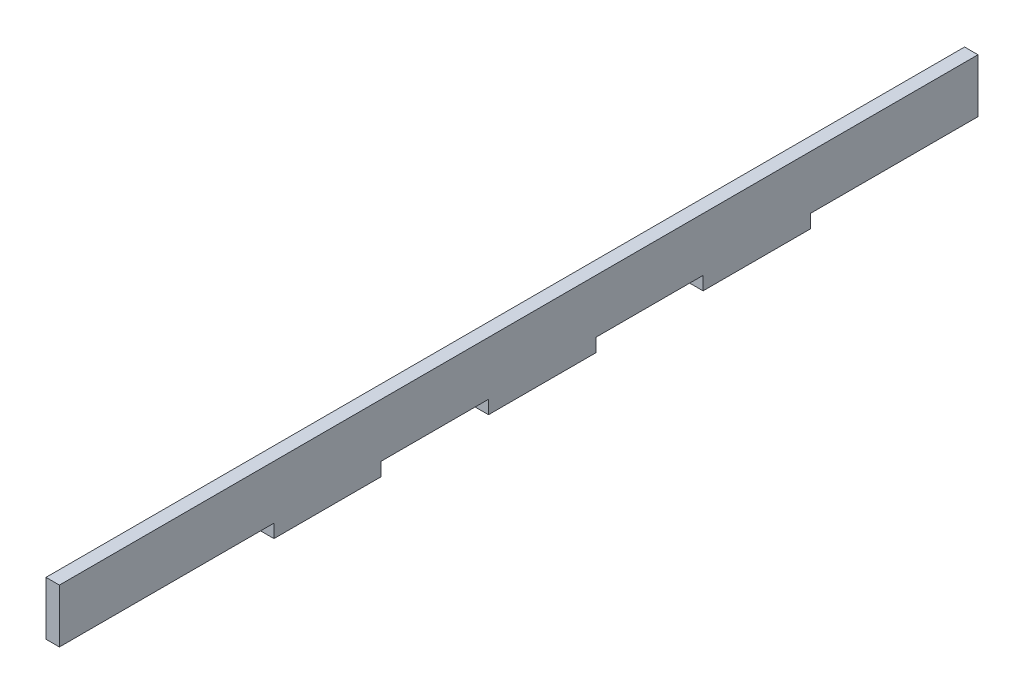
from build123d import *

# Parameters (mm, degrees)
SKETCH1_W           = 435
SKETCH1_H           = 31.75
BOSS_EXTRUDE1_DEPTH = 6.35
CUT_EXTRUDE1_REACH  = 441.326
SKETCH2_W           = 101.6
SKETCH2_H           = 6.35
CUT_EXTRUDE2_REACH  = 441.326
SKETCH3_W           = 50.8
SKETCH3_H           = 6.35
SKETCH3_W_2         = 79.4


with BuildPart() as part:
    # Sketch1 → Boss-Extrude1 (new body)
    with BuildSketch(Plane(origin=(0, 0, 0), x_dir=(0, 0, -1), z_dir=(1, 0, 0))):
        with Locations((220.631015664, 15.875)):
            Rectangle(SKETCH1_W, SKETCH1_H)
    extrude(amount=BOSS_EXTRUDE1_DEPTH)

    # Sketch2 → Cut-Extrude1 (cut, up to next)
    with BuildSketch(Plane.ZY, mode=Mode.PRIVATE) as cut_extrude1_sk1:
        with Locations((-53.931015664, 3.175)):
            Rectangle(SKETCH2_W, SKETCH2_H)
    cut_extrude1_tool1 = extrude(cut_extrude1_sk1.sketch, amount=-CUT_EXTRUDE1_REACH, mode=Mode.PRIVATE) & part.part
    add(cut_extrude1_tool1.solids().sort_by_distance((0, 3.175, -53.931016))[0], mode=Mode.SUBTRACT)

    # Sketch3 → Cut-Extrude2 (cut, up to next)
    with BuildSketch(Plane.ZY, mode=Mode.PRIVATE) as cut_extrude2_sk1:
        with Locations((-180.931015664, 3.175)):
            Rectangle(SKETCH3_W, SKETCH3_H)
    cut_extrude2_tool1 = extrude(cut_extrude2_sk1.sketch, amount=-CUT_EXTRUDE2_REACH, mode=Mode.PRIVATE) & part.part
    # Sketch3 → Cut-Extrude2 (cut, up to next)
    with BuildSketch(Plane.ZY, mode=Mode.PRIVATE) as cut_extrude2_sk2:
        with Locations((-282.531015664, 3.175)):
            Rectangle(SKETCH3_W, SKETCH3_H)
    cut_extrude2_tool2 = extrude(cut_extrude2_sk2.sketch, amount=-CUT_EXTRUDE2_REACH, mode=Mode.PRIVATE) & part.part
    # Sketch3 → Cut-Extrude2 (cut, up to next)
    with BuildSketch(Plane.ZY, mode=Mode.PRIVATE) as cut_extrude2_sk3:
        with Locations((-398.431015664, 3.175)):
            Rectangle(SKETCH3_W_2, SKETCH3_H)
    cut_extrude2_tool3 = extrude(cut_extrude2_sk3.sketch, amount=-CUT_EXTRUDE2_REACH, mode=Mode.PRIVATE) & part.part
    add(cut_extrude2_tool1.solids().sort_by_distance((0, 3.175, -180.931016))[0], mode=Mode.SUBTRACT)
    add(cut_extrude2_tool2.solids().sort_by_distance((0, 3.175, -282.531016))[0], mode=Mode.SUBTRACT)
    add(cut_extrude2_tool3.solids().sort_by_distance((0, 3.175, -398.431016))[0], mode=Mode.SUBTRACT)


solid = part.part
